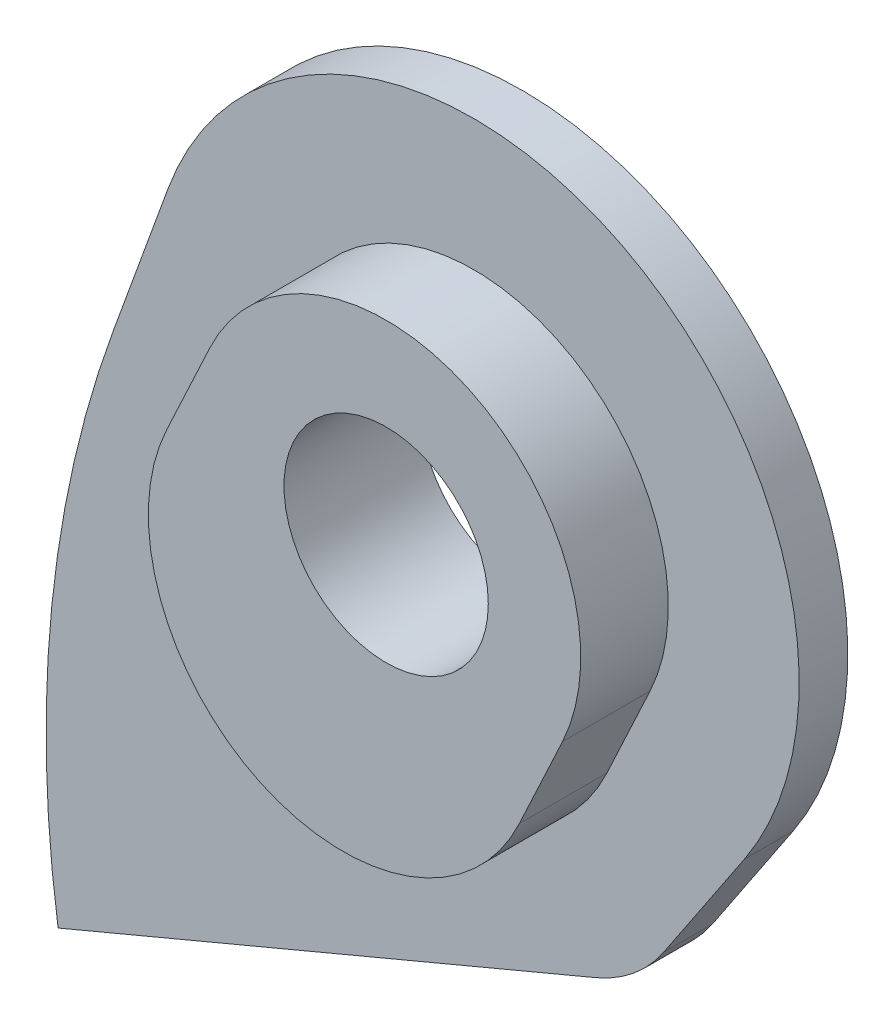
from build123d import *
from build123d.topology import SkipClean

# Parameters (mm, degrees)
SKETCH3_R           = 2.75
SKETCH3_R_2         = 2.1
BOSS_EXTRUDE2_DEPTH = 11
BOSS_EXTRUDE4_START = 1
BOSS_EXTRUDE4_DEPTH = 1
BOSS_EXTRUDE3_START = 3
BOSS_EXTRUDE3_DEPTH = 3
SKETCH14_W          = 47.285712055
SKETCH14_H          = 12.595473758
CUT_EXTRUDE1_DEPTH  = 92.326119258
BOSS_EXTRUDE5_DEPTH = 1.8
SKETCH15_R          = 2.1
CUT_EXTRUDE2_DEPTH  = 88.447358473


with BuildPart() as part:
    # Sketch3 → Boss-Extrude2 (new body)
    with BuildSketch(Plane.XY):
        with BuildLine():
            Line((11.81639044, 60.252883085), (11.728372068, 60.311638564))
            ThreePointArc((11.728372068, 60.311638564), (8.917204522, 62.7925154), (6.866230988, 65.931132995))
            ThreePointArc((6.866230988, 65.931132995), (6.025591445, 67.274340702), (4.901176311, 68.390840765))
            ThreePointArc((4.901176311, 68.390840765), (3.375934297, 70.989881123), (4.020351516, 73.93370524))
            Line((4.020351516, 73.93370524), (5.678869184, 76.41823992))
            ThreePointArc((5.678869184, 76.41823992), (3.137547336, 86.100651278), (-6.171856019, 82.420649156))
            Line((-6.171856019, 82.420649156), (-7.290261888, 79.347854286))
            ThreePointArc((-7.290261888, 79.347854286), (-8.557893098, 69.185727028), (-5.279809822, 59.483671095))
            ThreePointArc((-5.279809822, 59.483671095), (-2.848156457, 57.139360441), (0.414833066, 56.266646336))
            ThreePointArc((0.414833066, 56.266646336), (3.287818882, 55.822166382), (5.91364728, 54.574514525))
            Line((5.91364728, 54.574514525), (7.374782695, 53.599153256))
            ThreePointArc((7.374782695, 53.599153256), (10.815902262, 50.678650143), (13.499590609, 47.049812979))
            ThreePointArc((13.499590609, 47.049812979), (24.965953819, 46.665736496), (20.21385057, 57.108078892))
            ThreePointArc((20.21385057, 57.108078892), (15.833272198, 58.194897845), (11.81639044, 60.252883085))
        make_face()
        with Locations((19.351869275, 50.413343031)):
            Circle(SKETCH3_R, mode=Mode.SUBTRACT)
        with Locations((0.471910886, 63.016405008)):
            Circle(SKETCH3_R, mode=Mode.SUBTRACT)
        with Locations((0.114687614, 80.132534397)):
            Circle(SKETCH3_R_2, mode=Mode.SUBTRACT)
    extrude(amount=BOSS_EXTRUDE2_DEPTH)

    # Sketch13 → Boss-Extrude4 (add)
    with SkipClean():  # the faces are left unmerged after this step: merging them gives an invalid solid
        with BuildSketch(Plane(origin=(0, 0, 0), x_dir=(-1, 0, 0), z_dir=(0, 0, -1)).offset(BOSS_EXTRUDE4_START)):
            with BuildLine():
                Line((-5.678869184, 76.41823992), (-4.020351516, 73.93370524))
                ThreePointArc((-4.020351516, 73.93370524), (-3.407782277, 73.255690271), (-2.625844204, 72.782913134))
                Line((-2.625844204, 72.782913134), (8.427696777, 68.139691908))
                ThreePointArc((8.427696777, 68.139691908), (8.557268078, 73.814637343), (7.290261888, 79.347854286))
                Line((7.290261888, 79.347854286), (6.171856019, 82.420649156))
                ThreePointArc((6.171856019, 82.420649156), (-3.137547336, 86.100651278), (-5.678869184, 76.41823992))
            make_face()
        extrude(amount=-BOSS_EXTRUDE4_DEPTH)

    # Sketch12 → Boss-Extrude3 (add)
    with SkipClean():  # the faces are left unmerged after this step: merging them gives an invalid solid
        with BuildSketch(Plane(origin=(0, 0, -1), x_dir=(-1, 0, 0), z_dir=(0, 0, -1)).offset(BOSS_EXTRUDE3_START)):
            with BuildLine():
                Line((8.013597957, 76.965805827), (4.924247842, 69.611373108))
                Line((4.924247842, 69.611373108), (8.427696777, 68.139691908))
                ThreePointArc((8.427696777, 68.139691908), (8.649339764, 72.572862025), (8.013597957, 76.965805827))
            make_face()
        extrude(amount=-BOSS_EXTRUDE3_DEPTH)

    # Sketch14 → Cut-Extrude1 (cut, through all)
    with BuildSketch(Plane(origin=(0, 0, 0), x_dir=(1, 0, 0), z_dir=(0, 1, 0))):
        with Locations((8.412006537, -6.297736879)):
            Rectangle(SKETCH14_W, SKETCH14_H)
    extrude(amount=CUT_EXTRUDE1_DEPTH, mode=Mode.SUBTRACT)

    # Sketch16 → Boss-Extrude5 (add)
    with BuildSketch(Plane.XY):
        with BuildLine():
            Line((3.739918762, 78.44206135), (2.852420412, 76.538814997))
            ThreePointArc((2.852420412, 76.538814997), (-2.463283783, 74.604056896), (-4.398041884, 79.919761091))
            Line((-4.398041884, 79.919761091), (-3.510543534, 81.823007444))
            ThreePointArc((-3.510543534, 81.823007444), (1.805160661, 83.757765545), (3.739918762, 78.44206135))
        make_face()
    extrude(amount=BOSS_EXTRUDE5_DEPTH)

    # Sketch15 → Cut-Extrude2 (cut, through all)
    with BuildSketch(Plane.XY.offset(1.8)):
        with Locations((0.114687614, 80.132534397)):
            Circle(SKETCH15_R)
    extrude(amount=-CUT_EXTRUDE2_DEPTH, mode=Mode.SUBTRACT)


solid = part.part
